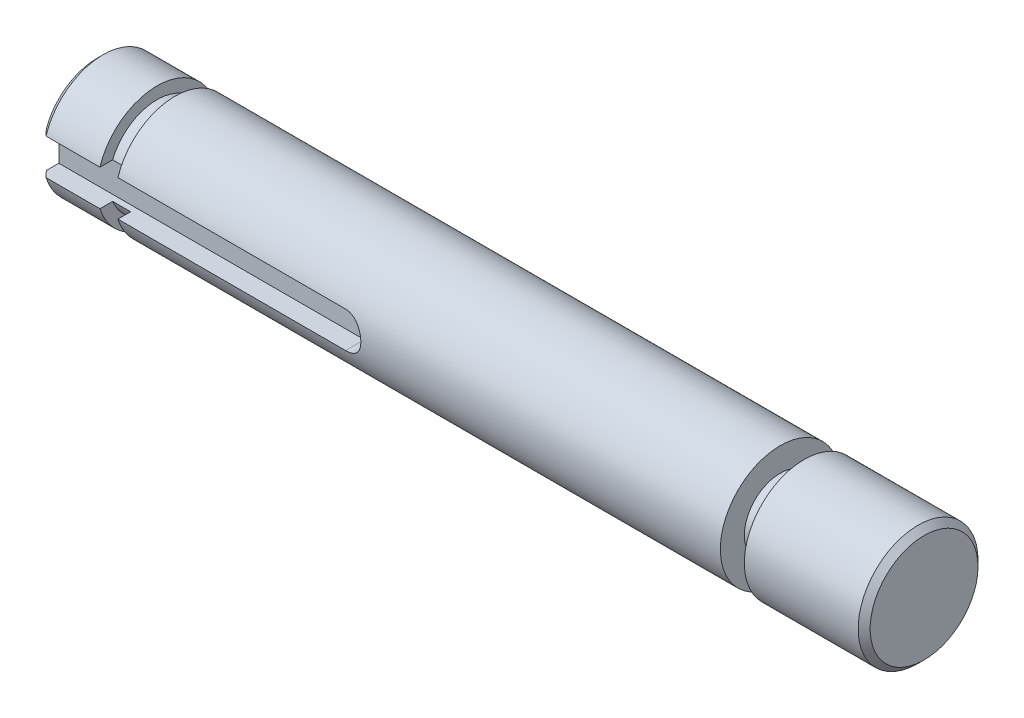
from build123d import *

# Parameters (mm, degrees)
SKETCH1_R           = 5
BOSS_EXTRUDE1_DEPTH = 34.5
CUT_EXTRUDE1_START  = -10
SKETCH2_R           = 5
SKETCH2_R_2         = 3
CUT_EXTRUDE1_DEPTH  = 2
CUT_EXTRUDE2_START  = -6.5
SKETCH3_R           = 5
SKETCH3_R_2         = 4
CUT_EXTRUDE2_DEPTH  = 1.5
CHAMFER1_SIZE       = 0.5
CUT_EXTRUDE3_START  = 3.2
CUT_EXTRUDE3_DEPTH  = 33.017183306


with BuildPart() as part:
    # Sketch1 → Boss-Extrude1 (new, symmetric)
    with BuildSketch(Plane(origin=(0, 0, 0), x_dir=(0, 0, -1), z_dir=(1, 0, 0))):
        Circle(SKETCH1_R)
    extrude(amount=BOSS_EXTRUDE1_DEPTH, both=True)

    # Sketch2 → Cut-Extrude1 (cut)
    with BuildSketch(Plane(origin=(34.5, 0, 0), x_dir=(0, 0, -1), z_dir=(1, 0, 0)).offset(CUT_EXTRUDE1_START)):
        Circle(SKETCH2_R)
        Circle(SKETCH2_R_2, mode=Mode.SUBTRACT)
    extrude(amount=-CUT_EXTRUDE1_DEPTH, mode=Mode.SUBTRACT)

    # Sketch3 → Cut-Extrude2 (cut)
    with BuildSketch(Plane.ZY.offset(34.5).offset(CUT_EXTRUDE2_START)):
        Circle(SKETCH3_R)
        Circle(SKETCH3_R_2, mode=Mode.SUBTRACT)
    extrude(amount=CUT_EXTRUDE2_DEPTH, mode=Mode.SUBTRACT)

    # Chamfer1
    chamfer1_edges = [part.edges().sort_by_distance(p)[0] for p in [
        (-34.5, 0, 5),
        (34.5, 0, 5),
    ]]
    chamfer(chamfer1_edges, length=CHAMFER1_SIZE)

    # Sketch4 → Cut-Extrude3 (cut, through all)
    with BuildSketch(Plane.XY.offset(CUT_EXTRUDE3_START)):
        with BuildLine():
            Line((-34.5, 1.5), (-9, 1.5))
            ThreePointArc((-9, 1.5), (-7.5, 0), (-9, -1.5))
            Line((-9, -1.5), (-34.5, -1.5))
            Line((-34.5, -1.5), (-34.5, 1.5))
        make_face()
    extrude(amount=CUT_EXTRUDE3_DEPTH, mode=Mode.SUBTRACT)


solid = part.part
